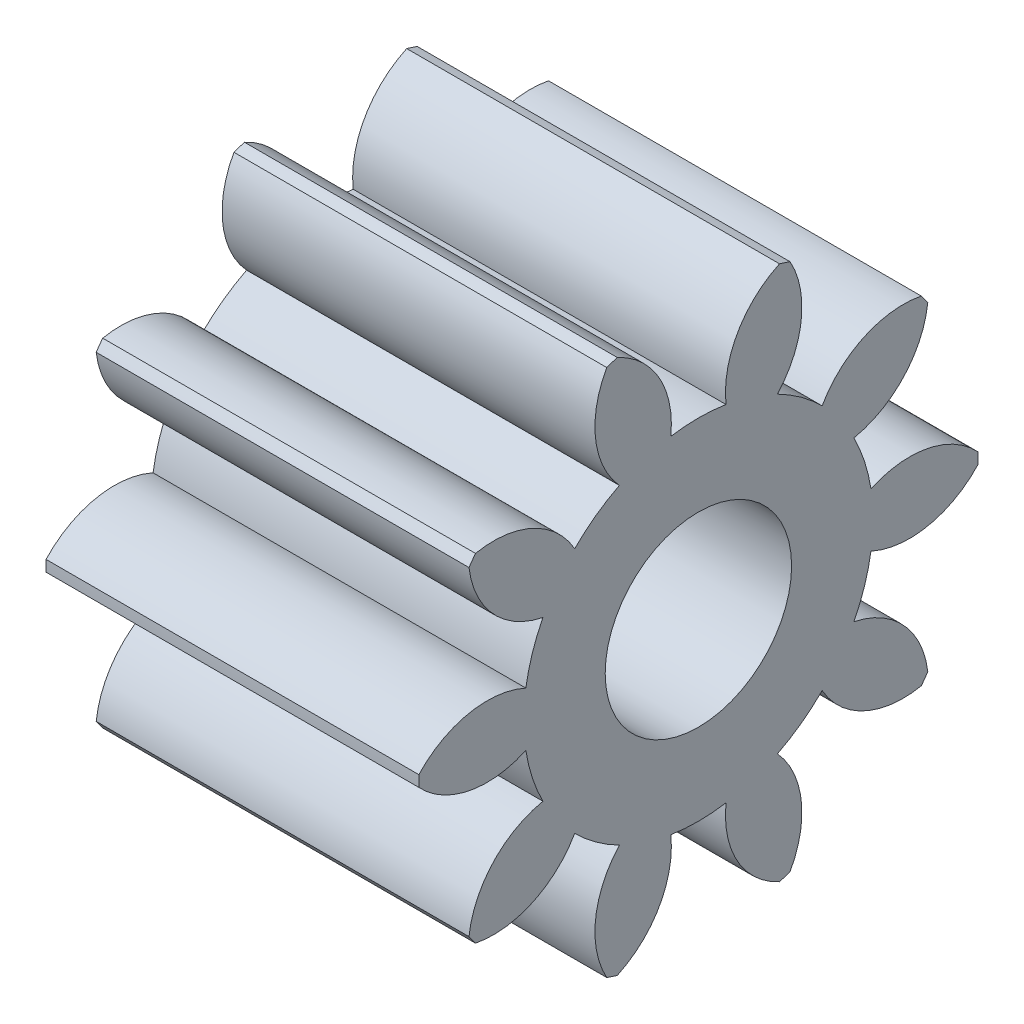
from build123d import *

# Parameters (mm, degrees)
BASPROSKE_W     = 4
BASPROSKE_H     = 3
TOOTHCUT_DEPTH  = 6.830951895
TEETHCUTS_COUNT = 10
TEETHCUTS_ANGLE = 324
BORSKE_R        = 1
BORE_DEPTH      = 50.0000508


with BuildPart() as part:
    # BasProSke → Base-Revolve (revolve)
    with BuildSketch(Plane(origin=(0, 0, 0), x_dir=(1, 0, 0), z_dir=(0, 1, 0)), mode=Mode.PRIVATE) as base_revolve_sk:
        with Locations((2, 1.5)):
            Rectangle(BASPROSKE_W, BASPROSKE_H)
    revolve(base_revolve_sk.sketch.rotate(Axis((-10, 0, 0), (1, 0, 0)), 180), axis=Axis((-10, 0, 0), (1, 0, 0)))

    # TooCutSke → ToothCut (cut, through all)
    with BuildSketch(Plane(origin=(0, 0, 0), x_dir=(0, 0, -1), z_dir=(1, 0, 0))):
        with BuildLine():
            ThreePointArc((0.296449938, 1.850403587), (0, 1.874), (-0.296449938, 1.850403587))
            ThreePointArc((-0.296449938, 1.850403587), (-0.428089565, 2.470295585), (-0.905889751, 2.886591228))
            ThreePointArc((-0.905889751, 2.886591228), (0, 3.0254), (0.905889751, 2.886591228))
            ThreePointArc((0.905889751, 2.886591228), (0.428089565, 2.470295585), (0.296449938, 1.850403587))
        make_face()
    toothcut = extrude(amount=TOOTHCUT_DEPTH, mode=Mode.SUBTRACT)

    # TeethCuts: ToothCut ×10 about axis
    teethcuts_axis = Axis((-10, 0, 0), (1, 0, 0))
    for i in range(1, TEETHCUTS_COUNT):
        add(toothcut.rotate(teethcuts_axis, i * TEETHCUTS_ANGLE / (TEETHCUTS_COUNT - 1)), mode=Mode.SUBTRACT)

    # BorSke → Bore (cut, symmetric)
    with BuildSketch(Plane(origin=(0, 0, 0), x_dir=(0, 0, -1), z_dir=(1, 0, 0))):
        with Locations(Location((0, 0, 0), (0, 0, 180))):
            Circle(BORSKE_R)
    extrude(amount=BORE_DEPTH, both=True, mode=Mode.SUBTRACT)


solid = part.part
